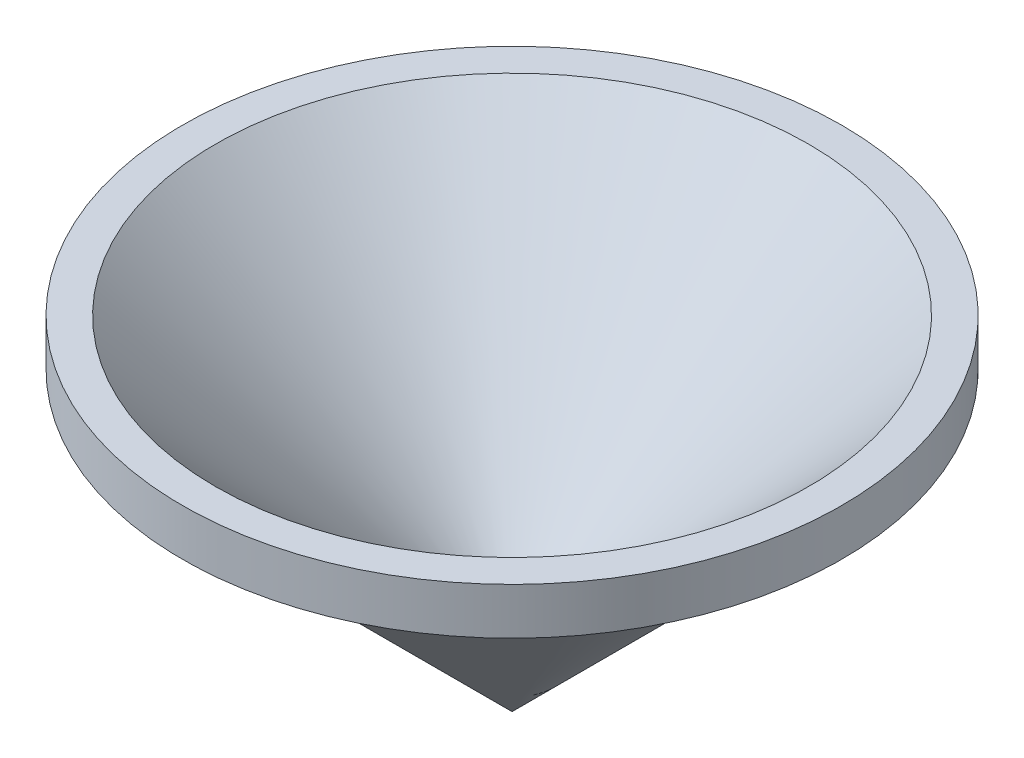
from build123d import *


with BuildPart() as part:
    # Sketch1 → Revolve1 (revolve)
    with BuildSketch(Plane.XY, mode=Mode.PRIVATE) as revolve1_sk:
        Polygon((0, 0), (18, 18), (20, 18), (20, 20.828427125), (18, 20.828427125), (0, 2.828427125), align=None)
    revolve(revolve1_sk.sketch.rotate(Axis((0, 0, 0), (0, 1, 0)), 270), axis=Axis((0, 0, 0), (0, 1, 0)))


solid = part.part
